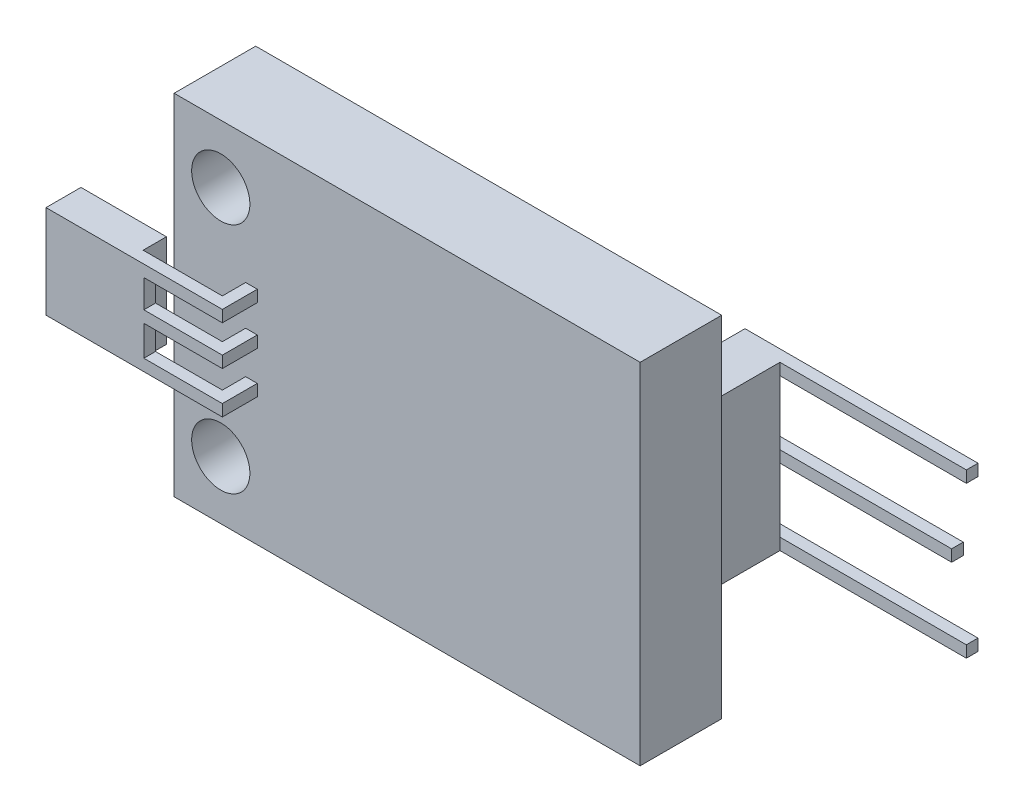
from build123d import *

# Parameters (mm, degrees)
SKETCH1_W           = 20
SKETCH1_H           = 15
BOSS_EXTRUDE1_DEPTH = 3.5
BOSS_EXTRUDE8_DEPTH = 1.5
SKETCH3_W           = 3.4
SKETCH3_H           = 1
CUT_EXTRUDE1_DEPTH  = 18.642278764
SKETCH7_R           = 1.25
CUT_EXTRUDE4_DEPTH  = 17.650825805
SKETCH8_W           = 10
SKETCH8_H           = 7
BOSS_EXTRUDE9_DEPTH = 4
CUT_EXTRUDE5_DEPTH  = 0.5
SKETCH10_W          = 8
SKETCH10_H          = 3.5
CUT_EXTRUDE6_DEPTH  = 21.856653615


with BuildPart() as part:
    # Sketch1 → Boss-Extrude1 (new body)
    with BuildSketch(Plane.XY):
        Rectangle(SKETCH1_W, SKETCH1_H)
    extrude(amount=BOSS_EXTRUDE1_DEPTH)

    # Sketch2 → Boss-Extrude8 (add)
    with BuildSketch(Plane.XY.offset(3.5)):
        Polygon((-6.431580724, 2), (-10, 2), (-10, 1.5), (-10, 0.3), (-10, -2), (-6.431580724, -2), (-6.431580724, -1.5), (-9.8, -1.5), (-9.8, -0.2), (-6.431580724, -0.2), (-6.431580724, 0.3), (-9.8, 0.3), (-9.8, 1.5), (-6.431580724, 1.5), align=None)
        Polygon((-10, 1.5), (-10, 2), (-14, 2), (-14, -2), (-10, -2), (-10, 0.3), align=None)
    extrude(amount=BOSS_EXTRUDE8_DEPTH)

    # Sketch3 → Cut-Extrude1 (cut, through all)
    with BuildSketch(Plane.XZ.offset(2)):
        with Locations((-8.631580724, 4)):
            Rectangle(SKETCH3_W, SKETCH3_H)
    extrude(amount=-CUT_EXTRUDE1_DEPTH, mode=Mode.SUBTRACT)

    # Sketch7 → Cut-Extrude4 (cut, through all)
    with BuildSketch(Plane(origin=(0, 0, 0), x_dir=(-1, 0, 0), z_dir=(0, 0, -1))):
        with Locations((8, -5)):
            Circle(SKETCH7_R)
        with Locations((8, 5)):
            Circle(SKETCH7_R)
    extrude(amount=-CUT_EXTRUDE4_DEPTH, mode=Mode.SUBTRACT)

    # Sketch8 → Boss-Extrude9 (add)
    with BuildSketch(Plane(origin=(0, 0, 0), x_dir=(-1, 0, 0), z_dir=(0, 0, -1))):
        with Locations((-12, 0)):
            Rectangle(SKETCH8_W, SKETCH8_H)
    extrude(amount=BOSS_EXTRUDE9_DEPTH)

    # Sketch9 → Cut-Extrude5 (cut)
    with BuildSketch(Plane(origin=(0, 0, -4), x_dir=(-1, 0, 0), z_dir=(0, 0, -1))):
        Polygon((-6, -3), (-18, -3), (-18, 3), (-6, 3), (-6, 0.25), (-16.368004225, 0.25), (-16.368004225, -0.25), (-6, -0.25), align=None)
    extrude(amount=-CUT_EXTRUDE5_DEPTH, mode=Mode.SUBTRACT)

    # Sketch10 → Cut-Extrude6 (cut, through all)
    with BuildSketch(Plane(origin=(0, 3.5, 0), x_dir=(1, 0, 0), z_dir=(0, 1, 0))):
        with Locations((13, 1.75)):
            Rectangle(SKETCH10_W, SKETCH10_H)
    extrude(amount=-CUT_EXTRUDE6_DEPTH, mode=Mode.SUBTRACT)


solid = part.part
